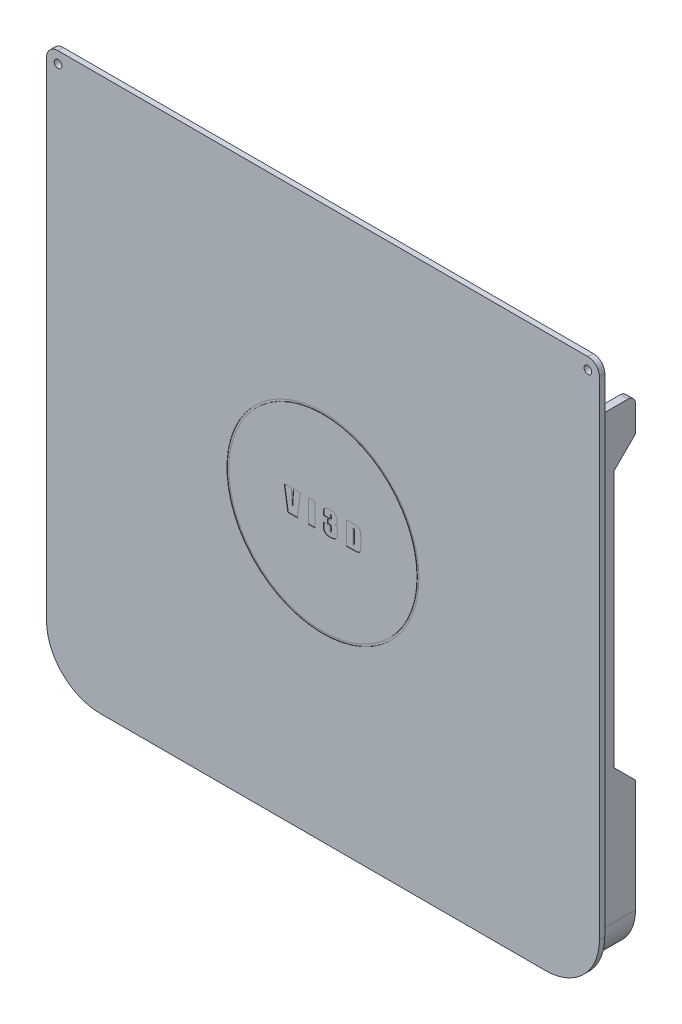
from build123d import *

# Parameters (mm, degrees)
BOSS_EXTRUDE1_DEPTH = 1.4
BOSS_EXTRUDE2_DEPTH = 10
CUT_EXTRUDE1_DEPTH  = 160
FILLET1_R           = 3
CUT_EXTRUDE2_DEPTH  = 160
SKETCH6_W           = 149.111366612
SKETCH6_H           = 20.141635169
CUT_EXTRUDE3_DEPTH  = 104
FILLET2_R           = 2
SKETCH7_R           = 1
CUT_EXTRUDE4_DEPTH  = 104
SKETCH8_R           = 25
SKETCH8_R_2         = 24.5
CUT_EXTRUDE5_DEPTH  = 0.1
SKETCH9_W           = 1.744186046
SKETCH9_H           = 6
CUT_EXTRUDE6_DEPTH  = 0.1


with BuildPart() as part:
    # Sketch1 → Boss-Extrude1 (new body)
    with BuildSketch(Plane.XY):
        with BuildLine():
            Line((-58, -72), (58, -72))
            ThreePointArc((58, -72), (67.899494937, -67.899494937), (72, -58))
            Line((72, -58), (72, 72))
            Line((72, 72), (-72, 72))
            Line((-72, 72), (-72, -58))
            ThreePointArc((-72, -58), (-67.899494937, -67.899494937), (-58, -72))
        make_face()
    extrude(amount=BOSS_EXTRUDE1_DEPTH)

    # Sketch2 → Boss-Extrude2 (add)
    with BuildSketch(Plane(origin=(0, 0, 0), x_dir=(-1, 0, 0), z_dir=(0, 0, -1))):
        with BuildLine():
            Line((-70, 70), (-70, -58))
            ThreePointArc((-70, -58), (-66.485281374, -66.485281374), (-58, -70))
            Line((-58, -70), (58, -70))
            ThreePointArc((58, -70), (66.485281374, -66.485281374), (70, -58))
            Line((70, -58), (70, 70))
            Line((70, 70), (-70, 70))
        make_face()
        with BuildLine():
            Line((-68, 68), (-68, -58))
            ThreePointArc((-68, -58), (-65.071067812, -65.071067812), (-58, -68))
            Line((-58, -68), (58, -68))
            ThreePointArc((58, -68), (65.071067812, -65.071067812), (68, -58))
            Line((68, -58), (68, 68))
            Line((68, 68), (-68, 68))
        make_face(mode=Mode.SUBTRACT)
    extrude(amount=BOSS_EXTRUDE2_DEPTH)

    # Sketch3 → Cut-Extrude1 (cut)
    with BuildSketch(Plane(origin=(70, 0, 0), x_dir=(0, 0, -1), z_dir=(1, 0, 0))):
        Polygon((10, 49.395826466), (4.343145751, 43.738972216), (4.343145751, -23.064979131), (10, -28.72183338), align=None)
    extrude(amount=-CUT_EXTRUDE1_DEPTH, mode=Mode.SUBTRACT)

    # Fillet1
    fillet1_edges = [part.edges().sort_by_distance(p)[0] for p in [
        (-72, 72, 0.7),
        (72, 72, 0.7),
        (-70, 70, -5),
        (70, 70, -5),
    ]]
    fillet(fillet1_edges, radius=FILLET1_R)

    # Sketch4 → Cut-Extrude2 (cut)
    with BuildSketch(Plane(origin=(0, 70, 0), x_dir=(1, 0, 0), z_dir=(0, 1, 0))):
        Polygon((-50, 6), (50, 6), (54, 10), (50, 10), (-50, 10), (-54, 10), align=None)
    extrude(amount=-CUT_EXTRUDE2_DEPTH, mode=Mode.SUBTRACT)

    # Sketch6 → Cut-Extrude3 (cut)
    with BuildSketch(Plane(origin=(0, 0, 0), x_dir=(-1, 0, 0), z_dir=(0, 0, -1))):
        with Locations((4.555683306, 68.268730817)):
            Rectangle(SKETCH6_W, SKETCH6_H)
    extrude(amount=CUT_EXTRUDE3_DEPTH, mode=Mode.SUBTRACT)

    # Fillet2
    fillet2_edges = [part.edges().sort_by_distance(p)[0] for p in [
        (-69, 58.197913233, -10),
        (69, 58.197913233, -10),
    ]]
    fillet(fillet2_edges, radius=FILLET2_R)

    # Sketch7 → Cut-Extrude4 (cut)
    with BuildSketch(Plane(origin=(0, 0, 0), x_dir=(-1, 0, 0), z_dir=(0, 0, -1))):
        with Locations((-69, 69)):
            Circle(SKETCH7_R)
        with Locations((69, 69)):
            Circle(SKETCH7_R)
    extrude(amount=-CUT_EXTRUDE4_DEPTH, mode=Mode.SUBTRACT)

    # Sketch8 → Cut-Extrude5 (cut)
    with BuildSketch(Plane.XY.offset(1.4)):
        Circle(SKETCH8_R)
        Circle(SKETCH8_R_2, mode=Mode.SUBTRACT)
    extrude(amount=-CUT_EXTRUDE5_DEPTH, mode=Mode.SUBTRACT)

    # Sketch9 → Cut-Extrude6 (cut)
    # profile 1 of 4: a face of its own
    with BuildSketch(Plane.XY.offset(1.4)):
        with BuildLine():
            Line((-5.88372093, 3.806649128), (-6.678415698, -2.193350872))
            Line((-6.678415698, -2.193350872), (-9.135537791, -2.193350872))
            Line((-9.135537791, -2.193350872), (-10.069767442, 3.806649128))
            Line((-10.069767442, 3.806649128), (-8.263444767, 3.806649128))
            add(Edge.make_bspline(
                [(-8.263444767, 3.806649128), (-8.244560195, 3.602464835), (-8.207641968, 3.20329656), (-8.15940031, 2.617038129), (-8.113848837, 2.057561024), (-8.075981556, 1.523702642), (-8.043145524, 1.01643092), (-8.015802358, 0.534953131), (-7.993650071, 0.080004515), (-7.982996014, -0.214777929), (-7.977834302, -0.357595058)],
                knots=[0, 0, 0, 0, 1.178864133, 2.304609988, 3.381786617, 4.40593996, 5.381447336, 6.304192654, 7.178409903, 8, 8, 8, 8], degree=3))
            add(Edge.make_bspline(
                [(-7.977834302, -0.357595058), (-7.972801253, -0.218785476), (-7.962892529, 0.054493341), (-7.947306492, 0.458638208), (-7.926704865, 0.851004115), (-7.907183315, 1.231937044), (-7.882098175, 1.6010183), (-7.858099824, 1.958353195), (-7.829121373, 2.303829361), (-7.808960387, 2.530131765), (-7.799055233, 2.641314826)],
                knots=[0, 0, 0, 0, 1.109477318, 2.18426311, 3.230447625, 4.247798164, 5.230899548, 6.185238292, 7.108402035, 8, 8, 8, 8], degree=3))
            Line((-7.799055233, 2.641314826), (-7.692223837, 3.806649128))
            Line((-7.692223837, 3.806649128), (-5.88372093, 3.806649128))
        make_face()
    # profile 2 of 4: a face of its own
    with BuildSketch(Plane.XY.offset(1.4)):
        with Locations((-2.953488372, 0.806649128)):
            Rectangle(SKETCH9_W, SKETCH9_H)
    # profile 3 of 4: a face of its own
    with BuildSketch(Plane.XY.offset(1.4)):
        with BuildLine():
            add(Edge.make_bspline(
                [(3.074854651, 1.133684012), (3.124676549, 1.118126211), (3.222805998, 1.087483492), (3.355905378, 1.009048344), (3.470789543, 0.905987142), (3.554828382, 0.801804293), (3.611396426, 0.698449781), (3.646087787, 0.598031963), (3.677582163, 0.478616068), (3.701715248, 0.338111021), (3.720960451, 0.177658173), (3.735032974, -0.003088376), (3.741909342, -0.204562096), (3.743401656, -0.345599583), (3.744186047, -0.419731686)],
                knots=[0, 0, 0, 0, 1.016999275, 2.003086655, 2.988662977, 4.019611082, 4.600825176, 5.281235464, 6.088694809, 7.011791237, 8.062992237, 9.244869897, 10.55184893, 12, 12, 12, 12], degree=3))
            add(Edge.make_bspline(
                [(3.744186047, -0.419731686), (3.743864198, -0.47569849), (3.743238983, -0.584418233), (3.735635631, -0.742989073), (3.722240971, -0.891988371), (3.705932494, -1.032314339), (3.680720454, -1.162850403), (3.655058179, -1.285384364), (3.620632491, -1.397584955), (3.582421027, -1.501648234), (3.537967707, -1.598553997), (3.483688139, -1.688787809), (3.42143166, -1.773268901), (3.352551967, -1.854210902), (3.273920269, -1.927855031), (3.186736825, -1.995875924), (3.092005642, -2.058945817), (2.989396505, -2.116775664), (2.879167773, -2.168371519), (2.760870186, -2.211033112), (2.636787398, -2.249926686), (2.504762276, -2.28001974), (2.365805716, -2.304245847), (2.219356855, -2.31953874), (2.066330095, -2.331541765), (1.96187212, -2.332430876), (1.908430233, -2.332885755)],
                knots=[0, 0, 0, 0, 1.306557405, 2.5380864, 3.704765356, 4.79909412, 5.8340718, 6.807597794, 7.720108215, 8.571034086, 9.394625542, 10.205003444, 11.024565392, 11.842589164, 12.682747966, 13.534688153, 14.421723298, 15.337186516, 16.282241429, 17.259272578, 18.270936405, 19.316292488, 20.418092949, 21.561971816, 22.75267706, 24, 24, 24, 24], degree=3))
            add(Edge.make_bspline(
                [(1.908430233, -2.332885755), (1.850643906, -2.331869781), (1.738238447, -2.329893517), (1.574357353, -2.31976115), (1.420252886, -2.299355577), (1.274640714, -2.274280315), (1.139038069, -2.239002957), (1.012078446, -2.19814998), (0.895577622, -2.147323881), (0.787104502, -2.091413961), (0.68980215, -2.027202007), (0.599237949, -1.962252343), (0.518625929, -1.8921958), (0.446319683, -1.819064891), (0.38231791, -1.74245154), (0.328226012, -1.661724189), (0.281488567, -1.578180657), (0.243654542, -1.488601391), (0.213101674, -1.389506249), (0.187395725, -1.277184694), (0.164130617, -1.149628878), (0.147937511, -1.006058669), (0.133759709, -0.847592076), (0.122431206, -0.673875617), (0.117835651, -0.484437012), (0.116811078, -0.3528721), (0.11627907, -0.284557267)],
                knots=[0, 0, 0, 0, 1.299894309, 2.528543083, 3.690267078, 4.794811967, 5.849363018, 6.839223044, 7.791105738, 8.705040887, 9.580108521, 10.410528004, 11.210131855, 11.978770916, 12.721736482, 13.451641089, 14.161315596, 14.871742675, 15.634274405, 16.490670547, 17.462174591, 18.548887091, 19.738703618, 21.040754322, 22.463417243, 24, 24, 24, 24], degree=3))
            Line((0.11627907, -0.284557267), (0.11627907, 0.248509593))
            Line((0.11627907, 0.248509593), (1.790697674, 0.248509593))
            Line((1.790697674, 0.248509593), (1.790697674, -0.770749128))
            add(Edge.make_bspline(
                [(1.790697674, -0.770749128), (1.790483429, -0.800911389), (1.790078101, -0.857975124), (1.792746089, -0.938271922), (1.795143296, -1.008747914), (1.796308117, -1.069539173), (1.801329941, -1.120709149), (1.805189778, -1.162231804), (1.810110667, -1.194095448), (1.818416233, -1.222117011), (1.830238, -1.246728916), (1.845585435, -1.26812565), (1.861797684, -1.283103991), (1.874437734, -1.285364011), (1.880087209, -1.286374128)],
                knots=[0, 0, 0, 0, 1.987693252, 3.760500629, 5.293927958, 6.635877218, 7.765507376, 8.680563431, 9.385305532, 9.88535678, 10.60300141, 11.168197135, 11.628225334, 12, 12, 12, 12], degree=3))
            add(Edge.make_bspline(
                [(1.880087209, -1.286374128), (1.896968929, -1.285143431), (1.929332925, -1.282784059), (1.974182441, -1.26393631), (2.008627586, -1.22974218), (2.028369365, -1.19085468), (2.041351185, -1.14930293), (2.047334872, -1.103270239), (2.055907344, -1.044238837), (2.060318877, -0.971356336), (2.064760663, -0.885253297), (2.068237204, -0.786035572), (2.068570178, -0.673363568), (2.069352868, -0.593786152), (2.069767442, -0.551635755)],
                knots=[0, 0, 0, 0, 0.731572703, 1.402500285, 2.06051521, 2.794294262, 3.273146828, 3.944630197, 4.803344522, 5.862883984, 7.110323324, 8.546188373, 10.170592374, 12, 12, 12, 12], degree=3))
            Line((2.069767442, -0.551635755), (2.069767442, -0.149382848))
            add(Edge.make_bspline(
                [(2.069767442, -0.149382848), (2.068775571, -0.100324543), (2.066943274, -0.009698389), (2.057889992, 0.115363019), (2.037275564, 0.217261156), (2.010724794, 0.299110098), (1.974129604, 0.362823021), (1.931519992, 0.414238106), (1.880121125, 0.453417457), (1.829895542, 0.476045427), (1.781864825, 0.488310554), (1.735103576, 0.498477984), (1.677417734, 0.505290044), (1.609054168, 0.511619239), (1.530266332, 0.518719636), (1.440401304, 0.522045496), (1.340166695, 0.527311048), (1.269630797, 0.528201479), (1.23255814, 0.528669477)],
                knots=[0, 0, 0, 0, 1.793675506, 3.313484076, 4.574097569, 5.586306684, 6.442883314, 7.243807127, 8.011447475, 8.78412609, 9.238394447, 9.821837147, 10.531824591, 11.359072006, 12.331829127, 13.422137894, 14.64511262, 16, 16, 16, 16], degree=3))
            Line((1.23255814, 0.528669477), (1.23255814, 1.504323547))
            add(Edge.make_bspline(
                [(1.23255814, 1.504323547), (1.276528944, 1.504079643), (1.360116478, 1.503615987), (1.477828411, 1.506687841), (1.581450241, 1.507801765), (1.670073742, 1.512822172), (1.744976376, 1.516766274), (1.805041721, 1.521761192), (1.850923039, 1.528158219), (1.892578301, 1.537204806), (1.932333279, 1.557262309), (1.971525531, 1.5896585), (2.003502972, 1.632372808), (2.029285261, 1.686307404), (2.049053028, 1.755386693), (2.060113956, 1.842705853), (2.069597829, 1.94925125), (2.069707696, 2.026821374), (2.069767442, 2.069003779)],
                knots=[0, 0, 0, 0, 1.682325911, 3.198064671, 4.50529133, 5.646735599, 6.59380925, 7.375503669, 7.951619635, 8.366401507, 9.000651985, 9.632612468, 10.29722399, 11.024738208, 11.909006447, 13.033731603, 14.386951991, 16, 16, 16, 16], degree=3))
            Line((2.069767442, 2.069003779), (2.069767442, 2.396038663))
            add(Edge.make_bspline(
                [(2.069767442, 2.396038663), (2.06974695, 2.439675255), (2.069710181, 2.517974941), (2.060589713, 2.621686768), (2.04997062, 2.699511308), (2.030566435, 2.753869153), (2.003921501, 2.789107682), (1.973550114, 2.812857774), (1.937342121, 2.828018229), (1.911125953, 2.829260595), (1.89752907, 2.829904942)],
                knots=[0, 0, 0, 0, 2.008094162, 3.603240638, 4.79155147, 5.618041141, 6.227087647, 6.799403068, 7.377316434, 8, 8, 8, 8], degree=3))
            add(Edge.make_bspline(
                [(1.89752907, 2.829904942), (1.891566015, 2.828854701), (1.878079316, 2.826479359), (1.858954635, 2.811854717), (1.842983217, 2.787606997), (1.825985791, 2.76349177), (1.816971706, 2.734588425), (1.809043088, 2.704575772), (1.80460702, 2.665311314), (1.798405596, 2.61821653), (1.796249368, 2.561721736), (1.792064671, 2.497110973), (1.791946591, 2.42364701), (1.791129325, 2.372053174), (1.790697674, 2.344803198)],
                knots=[0, 0, 0, 0, 0.412890648, 0.933838849, 1.594786378, 2.414855492, 2.945341294, 3.667899928, 4.553026953, 5.66166401, 6.940664904, 8.444651741, 10.122195142, 12, 12, 12, 12], degree=3))
            Line((1.790697674, 2.344803198), (1.790697674, 1.783393314))
            Line((1.790697674, 1.783393314), (0.11627907, 1.783393314))
            Line((0.11627907, 1.783393314), (0.11627907, 2.35897471))
            add(Edge.make_bspline(
                [(0.11627907, 2.35897471), (0.117531109, 2.429871781), (0.119930694, 2.565748881), (0.138116543, 2.760805999), (0.169462484, 2.938040125), (0.212411947, 3.097836171), (0.267762131, 3.240251715), (0.33657848, 3.364986143), (0.418896935, 3.472046277), (0.51459437, 3.562078804), (0.624109385, 3.637002239), (0.746653701, 3.700847281), (0.88287234, 3.75549181), (1.032933, 3.799864808), (1.197002724, 3.834354865), (1.374708752, 3.859320016), (1.566646814, 3.872969229), (1.699107164, 3.875239261), (1.767805233, 3.87641657)],
                knots=[0, 0, 0, 0, 1.298550657, 2.488724752, 3.584151192, 4.591751301, 5.515053573, 6.376187264, 7.192311119, 7.978659213, 8.772604778, 9.615197723, 10.505123881, 11.456967176, 12.477846445, 13.57353574, 14.741559969, 16, 16, 16, 16], degree=3))
            add(Edge.make_bspline(
                [(1.767805233, 3.87641657), (1.856885461, 3.875492639), (2.027709953, 3.873720865), (2.272733329, 3.85122123), (2.495433411, 3.817211419), (2.696596592, 3.770187527), (2.875336831, 3.707480338), (3.031591888, 3.629679839), (3.167046967, 3.539678556), (3.278541928, 3.432216674), (3.372124931, 3.314395355), (3.453563087, 3.18853355), (3.521106199, 3.052873732), (3.5781524, 2.909061229), (3.621696488, 2.755642009), (3.651766959, 2.593215949), (3.670644496, 2.421918631), (3.673142035, 2.304519076), (3.674418605, 2.2445125)],
                knots=[0, 0, 0, 0, 1.476208767, 2.830848283, 4.074675624, 5.208397248, 6.250538587, 7.20684012, 8.095653609, 8.935002587, 9.761896075, 10.585624241, 11.415321211, 12.269899416, 13.146939477, 14.054236755, 15.005459686, 16, 16, 16, 16], degree=3))
            add(Edge.make_bspline(
                [(3.674418605, 2.2445125), (3.674044376, 2.204166409), (3.673322357, 2.126324673), (3.666586105, 2.013957714), (3.656441697, 1.909724618), (3.639282458, 1.813920976), (3.621004068, 1.725271052), (3.594951443, 1.645610049), (3.567794069, 1.572889001), (3.521755934, 1.488454078), (3.452264568, 1.392206495), (3.345952734, 1.29288745), (3.220784418, 1.202457886), (3.124789552, 1.157217364), (3.074854651, 1.133684012)],
                knots=[0, 0, 0, 0, 1.069516936, 2.063472651, 2.983732849, 3.843728224, 4.643095149, 5.380437002, 6.063820548, 6.697379831, 7.92483877, 9.192177047, 10.539418137, 12, 12, 12, 12], degree=3))
        make_face()
    # profile 4 of 4: a face of its own
    with BuildSketch(Plane.XY.offset(1.4)):
        with BuildLine():
            Line((6.081395349, 3.806649128), (7.301235465, 3.806649128))
            add(Edge.make_bspline(
                [(7.301235465, 3.806649128), (7.392078262, 3.806038071), (7.566506396, 3.804864773), (7.817298985, 3.801338125), (8.046233033, 3.792199663), (8.253148348, 3.781223628), (8.437682138, 3.764159916), (8.600428153, 3.74680943), (8.741230081, 3.724085515), (8.896621938, 3.69030763), (9.06498157, 3.637405947), (9.243402656, 3.555634563), (9.396209277, 3.455299657), (9.520925934, 3.335790436), (9.622264536, 3.206804066), (9.703257651, 3.071818683), (9.761533134, 2.930660642), (9.793521671, 2.806450469), (9.808466655, 2.697082166), (9.819263056, 2.598931577), (9.829105134, 2.484459538), (9.836532949, 2.353591802), (9.841523027, 2.20601645), (9.846210022, 2.042140851), (9.847944026, 1.861521452), (9.848530448, 1.73579145), (9.848837209, 1.670021221)],
                knots=[0, 0, 0, 0, 1.608076528, 3.087683303, 4.439404138, 5.663549595, 6.754847868, 7.719448484, 8.560111935, 9.278004639, 10.533121515, 11.675539304, 12.742337604, 13.752402653, 14.718781573, 15.638774301, 16.529869777, 17.4128498, 17.900418276, 18.48286973, 19.160716673, 19.933880813, 20.802809713, 21.77439757, 22.83577208, 24, 24, 24, 24], degree=3))
            Line((9.848837209, 1.670021221), (9.848837209, -0.382667732))
            add(Edge.make_bspline(
                [(9.848837209, -0.382667732), (9.848615767, -0.445531606), (9.848192049, -0.565818117), (9.845346196, -0.73846725), (9.838658854, -0.8950983), (9.830113275, -1.036126965), (9.819513869, -1.161210497), (9.806567713, -1.270299169), (9.792034532, -1.363671281), (9.76783678, -1.465063563), (9.728295138, -1.576584388), (9.663845311, -1.696303268), (9.581943947, -1.802576141), (9.48379754, -1.894335011), (9.372243931, -1.973236577), (9.247377211, -2.036766308), (9.112946045, -2.091377082), (8.991152823, -2.123223368), (8.885392846, -2.142954503), (8.796828332, -2.15758087), (8.699549235, -2.167408396), (8.594291974, -2.178249804), (8.480031657, -2.183657095), (8.357245615, -2.18959799), (8.22603323, -2.19274164), (8.135902352, -2.193143492), (8.089389535, -2.193350872)],
                knots=[0, 0, 0, 0, 1.478734919, 2.829476684, 4.06137859, 5.166118923, 6.152785868, 7.01366383, 7.749986524, 8.374009491, 9.46356733, 10.522969481, 11.559011643, 12.605054276, 13.672220739, 14.761812103, 15.893503275, 17.079476534, 17.714812017, 18.424456955, 19.189967589, 20.014121617, 20.91306878, 21.879876575, 22.905892002, 24, 24, 24, 24], degree=3))
            Line((8.089389535, -2.193350872), (6.081395349, -2.193350872))
            Line((6.081395349, -2.193350872), (6.081395349, 3.806649128))
        make_face()
        with BuildLine():
            Line((7.825581395, 2.690370058), (7.825581395, -1.077071802))
            add(Edge.make_bspline(
                [(7.825581395, -1.077071802), (7.84973328, -1.076119552), (7.895091389, -1.074331193), (7.957498297, -1.053157077), (8.007391277, -1.017781441), (8.041387312, -0.976859037), (8.0587567, -0.93027614), (8.071568861, -0.881042464), (8.081996858, -0.817164403), (8.090326902, -0.738922984), (8.096763891, -0.645829413), (8.100538942, -0.538211163), (8.104219853, -0.416121582), (8.104502245, -0.329982343), (8.104651163, -0.284557267)],
                knots=[0, 0, 0, 0, 0.91741967, 1.722947146, 2.468041254, 3.226896813, 3.705039043, 4.349752385, 5.164505113, 6.16735007, 7.346950983, 8.718547195, 10.269543081, 12, 12, 12, 12], degree=3))
            Line((8.104651163, -0.284557267), (8.104651163, 2.023218896))
            add(Edge.make_bspline(
                [(8.104651163, 2.023218896), (8.104722722, 2.054468642), (8.104858357, 2.113700173), (8.103957464, 2.197655361), (8.101345132, 2.272126181), (8.099735895, 2.33757622), (8.096107078, 2.393871023), (8.09320978, 2.441171048), (8.089224796, 2.479076947), (8.08215772, 2.516510839), (8.070228419, 2.554353377), (8.050823442, 2.594002096), (8.023163084, 2.625963859), (7.978171852, 2.657909336), (7.912023261, 2.685845009), (7.854971593, 2.688831544), (7.825581395, 2.690370058)],
                knots=[0, 0, 0, 0, 1.579849338, 2.994484889, 4.244208274, 5.347040918, 6.303887078, 7.095731891, 7.742879144, 8.229259728, 9.019397977, 9.74240569, 10.445776282, 11.129192478, 12.521101964, 14, 14, 14, 14], degree=3))
        make_face(mode=Mode.SUBTRACT)
    extrude(amount=-CUT_EXTRUDE6_DEPTH, mode=Mode.SUBTRACT)


solid = part.part
